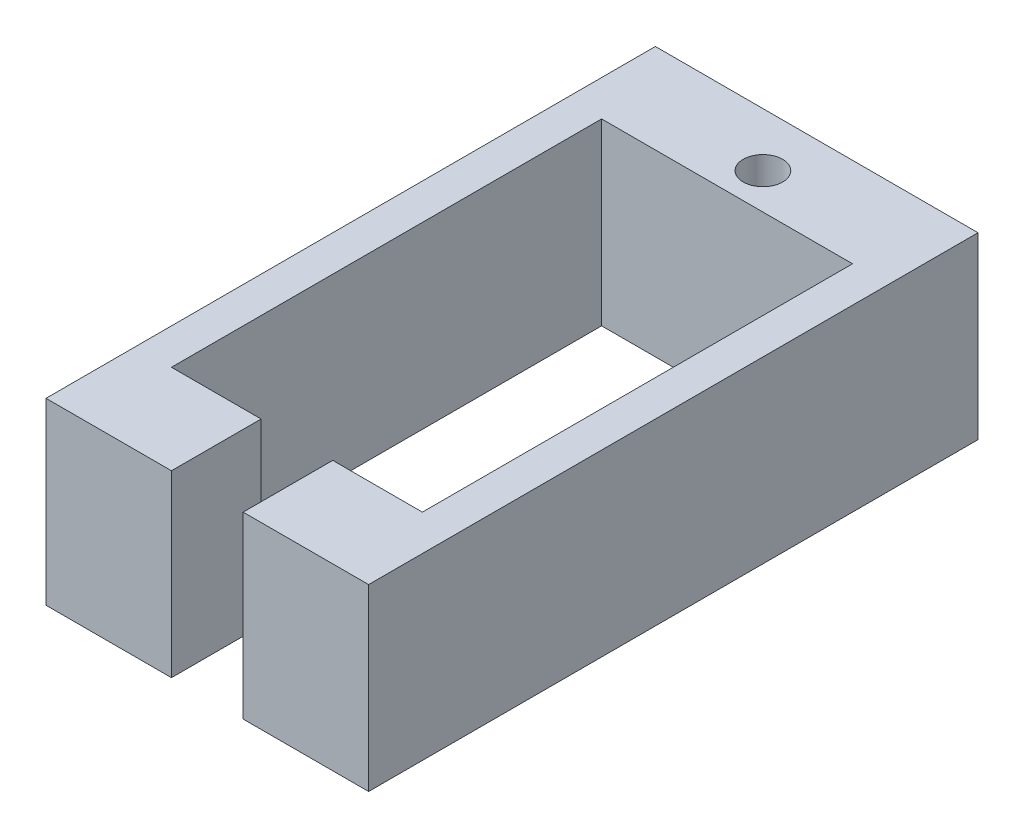
from build123d import *

# Parameters (mm, degrees)
SKETCH_1_W          = 18
SKETCH_1_H          = 34
SKETCH_1_W_2        = 14
SKETCH_1_H_2        = 24
EXTRUDE_1_DEPTH     = 10
SKETCH_2_R          = 1.1
CUT_EXTRUDE_1_DEPTH = 22.679483389
SKETCH_4_W          = 4
SKETCH_4_H          = 10
CUT_EXTRUDE_2_DEPTH = 10


with BuildPart() as part:
    # 草图1 → 凸台-拉伸1 (new body)
    with BuildSketch(Plane(origin=(0, 0, 0), x_dir=(1, 0, 0), z_dir=(0, 1, 0))):
        Rectangle(SKETCH_1_W, SKETCH_1_H)
        Rectangle(SKETCH_1_W_2, SKETCH_1_H_2, mode=Mode.SUBTRACT)
    extrude(amount=EXTRUDE_1_DEPTH)

    # 草图2 → 切除-拉伸1 (cut, through all)
    with BuildSketch(Plane.XZ):
        with Locations(Location((0, 14, 0), (0, 0, 270))):
            Circle(SKETCH_2_R)
        with Locations(Location((0, -14, 0), (0, 0, 90))):
            Circle(SKETCH_2_R)
    extrude(amount=-CUT_EXTRUDE_1_DEPTH, mode=Mode.SUBTRACT)

    # 草图4 → 切除-拉伸2 (cut)
    with BuildSketch(Plane.XY.offset(17)):
        with Locations((0, 5)):
            Rectangle(SKETCH_4_W, SKETCH_4_H)
    extrude(amount=-CUT_EXTRUDE_2_DEPTH, mode=Mode.SUBTRACT)


solid = part.part
